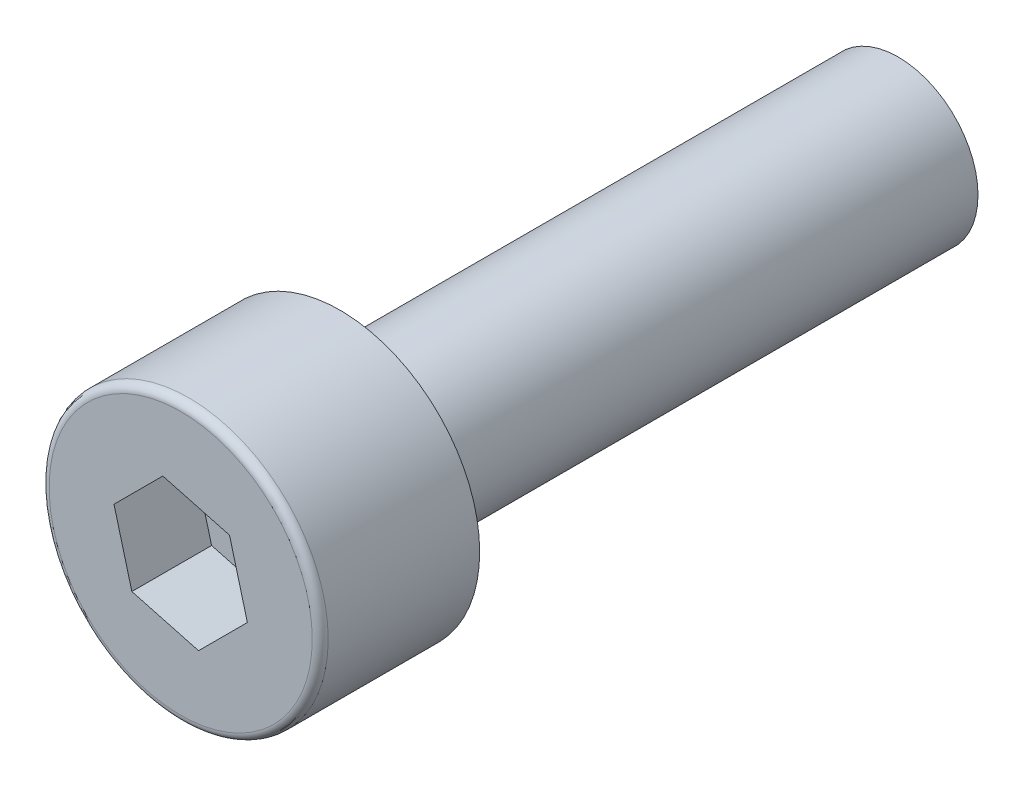
from build123d import *

# Parameters (mm, degrees)
SKETCH_1_R          = 3.5
EXTRUDE_1_DEPTH     = 4
CUT_EXTRUDE_1_DEPTH = 2
SKETCH_3_R          = 2
EXTRUDE_2_DEPTH     = 14
FILLET_1_R          = 0.2


with BuildPart() as part:
    # 草图1 → 凸台-拉伸1 (new body)
    with BuildSketch(Plane.XY):
        Circle(SKETCH_1_R)
    extrude(amount=EXTRUDE_1_DEPTH)

    # 草图2 → 切除-拉伸1 (cut)
    with BuildSketch(Plane.XY.offset(4)):
        Polygon((-1.224744871, -1.224744871), (0.448287736, -1.673032607), (1.673032607, -0.448287736), (1.224744871, 1.224744871), (-0.448287736, 1.673032607), (-1.673032607, 0.448287736), align=None)
    extrude(amount=-CUT_EXTRUDE_1_DEPTH, mode=Mode.SUBTRACT)

    # 草图3 → 凸台-拉伸2 (add)
    with BuildSketch(Plane(origin=(0, 0, 0), x_dir=(-1, 0, 0), z_dir=(0, 0, -1))):
        with Locations(Location((0, 0, 0), (0, 0, 180))):
            Circle(SKETCH_3_R)
    extrude(amount=EXTRUDE_2_DEPTH)

    # 圆角1
    fillet_1_edges = [part.edges().sort_by_distance(p)[0] for p in [
        (-3.5, 0, 4),
    ]]
    fillet(fillet_1_edges, radius=FILLET_1_R)


solid = part.part
